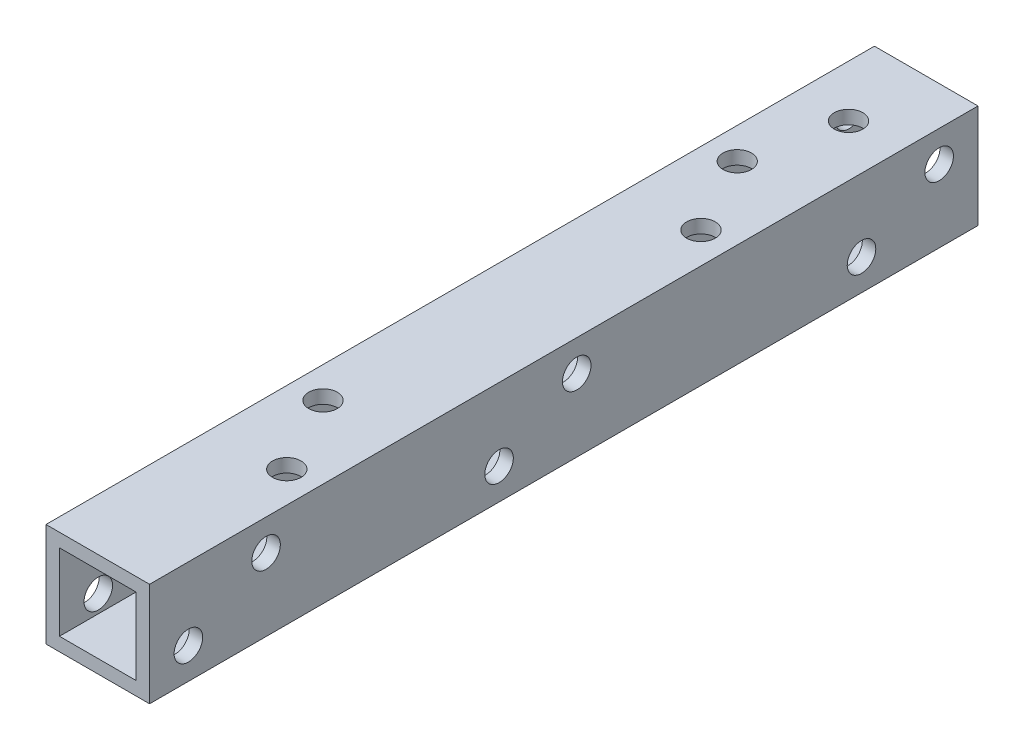
from build123d import *

# Parameters (mm, degrees)
SKETCH1_W           = 12.7
SKETCH1_H           = 12.7
SKETCH1_W_2         = 9.398
SKETCH1_H_2         = 9.398
BOSS_EXTRUDE1_DEPTH = 101.6
SKETCH2_R           = 1.75
CUT_EXTRUDE1_DEPTH  = 22.2885
SKETCH3_R           = 1.75
CUT_EXTRUDE2_DEPTH  = 22.098
SKETCH4_R           = 1.75
CUT_EXTRUDE3_DEPTH  = 24.892


with BuildPart() as part:
    # Sketch1 → Boss-Extrude1 (new body)
    with BuildSketch(Plane(origin=(0, 0, 0), x_dir=(0, 1, 0), z_dir=(0, 0, 1))):
        Rectangle(SKETCH1_W, SKETCH1_H)
        Rectangle(SKETCH1_W_2, SKETCH1_H_2, mode=Mode.SUBTRACT)
    extrude(amount=BOSS_EXTRUDE1_DEPTH)

    # Sketch2 → Cut-Extrude1 (cut)
    with BuildSketch(Plane(origin=(0, 6.35, 0), x_dir=(-1, 0, 0), z_dir=(0, 1, 0))):
        with Locations((-2.54, 80.9625)):
            Circle(SKETCH2_R)
        with Locations((2.54, 71.4375)):
            Circle(SKETCH2_R)
        with Locations((-2.54, 30.1625)):
            Circle(SKETCH2_R)
        with Locations((2.54, 20.6375)):
            Circle(SKETCH2_R)
    extrude(amount=-CUT_EXTRUDE1_DEPTH, mode=Mode.SUBTRACT)

    # Sketch3 → Cut-Extrude2 (cut)
    with BuildSketch(Plane.YZ.offset(6.35)):
        with Locations((-2.54, 14.2875)):
            Circle(SKETCH3_R)
        with Locations((2.54, 4.7625)):
            Circle(SKETCH3_R)
        with Locations((-2.54, 96.8375)):
            Circle(SKETCH3_R)
        with Locations((2.54, 87.3125)):
            Circle(SKETCH3_R)
        with Locations((-2.54, 58.7375)):
            Circle(SKETCH3_R)
        with Locations((2.54, 49.2125)):
            Circle(SKETCH3_R)
    extrude(amount=-CUT_EXTRUDE2_DEPTH, mode=Mode.SUBTRACT)

    # Sketch4 → Cut-Extrude3 (cut)
    with BuildSketch(Plane(origin=(0, 6.35, 0), x_dir=(-1, 0, 0), z_dir=(0, 1, 0))):
        with Locations((0, 9.525)):
            Circle(SKETCH4_R)
    extrude(amount=-CUT_EXTRUDE3_DEPTH, mode=Mode.SUBTRACT)


solid = part.part
